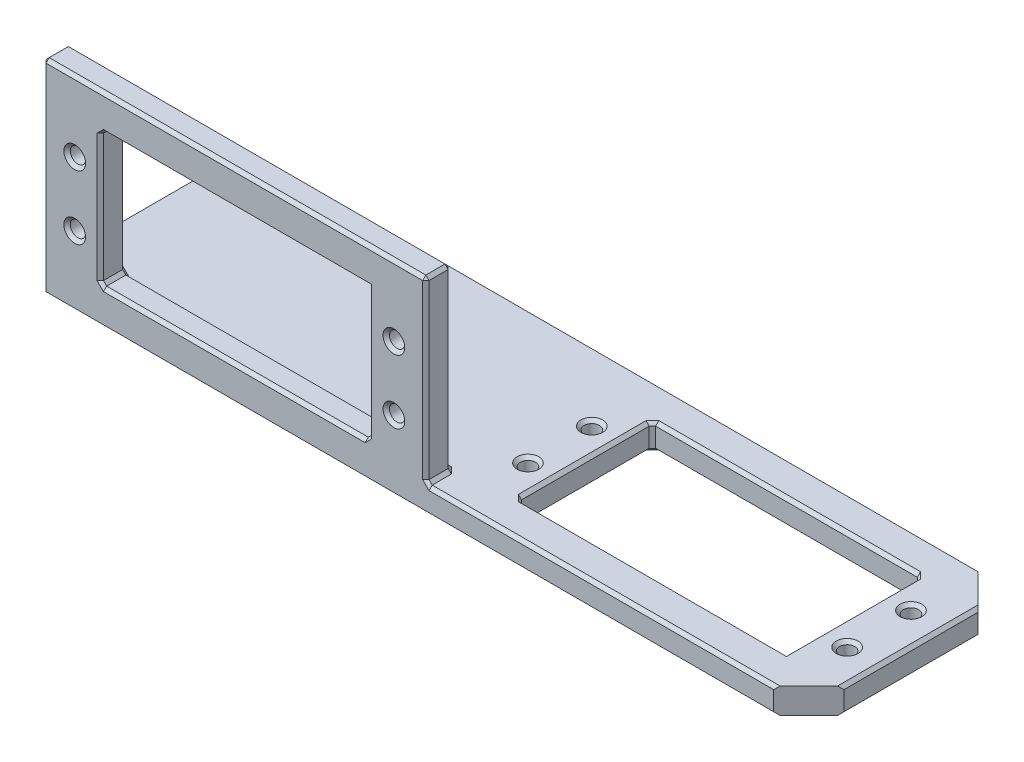
from build123d import *

# Parameters (mm, degrees)
SKETCH2_W           = 120
SKETCH2_H           = 32
BOSS_EXTRUDE1_DEPTH = 4
SKETCH3_R           = 1.2
SKETCH3_W           = 42
SKETCH3_H           = 21
CUT_EXTRUDE1_DEPTH  = 4
SKETCH4_W           = 60
SKETCH4_H           = 32
BOSS_EXTRUDE2_DEPTH = 4
SKETCH5_R           = 1.2
SKETCH5_W           = 42
SKETCH5_H           = 21
CUT_EXTRUDE2_DEPTH  = 76.153176912
CHAMFER1_SIZE       = 0.5
CHAMFER2_SIZE       = 0.5
CUT_EXTRUDE3_DEPTH  = 10


with BuildPart() as part:
    # Sketch2 → Boss-Extrude1 (new body)
    with BuildSketch(Plane(origin=(0, 0, 0), x_dir=(1, 0, 0), z_dir=(0, 1, 0))):
        Rectangle(SKETCH2_W, SKETCH2_H)
    extrude(amount=BOSS_EXTRUDE1_DEPTH)

    # Sketch3 → Cut-Extrude1 (cut)
    with BuildSketch(Plane(origin=(0, 4, 0), x_dir=(1, 0, 0), z_dir=(0, 1, 0))):
        with Locations(Location((55, 5, 0), (0, 0, 270))):
            Circle(SKETCH3_R)
        with Locations(Location((55, -5, 0), (0, 0, 270))):
            Circle(SKETCH3_R)
        with Locations(Location((5, 5, 0), (0, 0, 270))):
            Circle(SKETCH3_R)
        with Locations(Location((5, -5, 0), (0, 0, 270))):
            Circle(SKETCH3_R)
        with Locations((30, 0)):
            Rectangle(SKETCH3_W, SKETCH3_H)
    extrude(amount=-CUT_EXTRUDE1_DEPTH, mode=Mode.SUBTRACT)

    # Sketch4 → Boss-Extrude2 (add)
    with BuildSketch(Plane.XY.offset(16)):
        with Locations((-30, 16)):
            Rectangle(SKETCH4_W, SKETCH4_H)
    extrude(amount=-BOSS_EXTRUDE2_DEPTH)

    # Sketch5 → Cut-Extrude2 (cut, through all)
    with BuildSketch(Plane.XY.offset(16)):
        with Locations((-5, 21)):
            Circle(SKETCH5_R)
        with Locations((-5, 11)):
            Circle(SKETCH5_R)
        with Locations((-55, 21)):
            Circle(SKETCH5_R)
        with Locations((-55, 11)):
            Circle(SKETCH5_R)
        with Locations((-30, 16)):
            Rectangle(SKETCH5_W, SKETCH5_H)
    extrude(amount=-CUT_EXTRUDE2_DEPTH, mode=Mode.SUBTRACT)

    # Chamfer1
    chamfer1_edges = [part.edges().sort_by_distance(p)[0] for p in [
        (-60, 4, -2),
        (5, 0, 3.8),
        (5, 4, 3.8),
        (5, 0, -6.2),
        (5, 4, -6.2),
        (55, 0, 3.8),
        (55, 4, 3.8),
        (55, 0, -6.2),
        (55, 4, -6.2),
        (51, 0, 0),
        (51, 2, -10.5),
        (30, 0, 10.5),
        (9, 0, 0),
        (9, 2, 10.5),
        (30, 0, -10.5),
        (9, 2, -10.5),
        (51, 4, 0),
        (30, 4, -10.5),
        (9, 4, 0),
        (30, 4, 10.5),
        (60, 4, 0),
        (0, 0, 16),
        (30, 4, 16),
        (-60, 18, 12),
        (-30, 32, 12),
        (-60, 32, 14),
        (0, 4, 14),
        (0, 18, 12),
        (0, 32, 14),
        (-30, 4, 12),
        (0, 18, 16),
        (-30, 32, 16),
        (60, 0, 0),
        (-30, 26.5, 12),
        (-51, 16, 12),
        (-30, 5.5, 12),
        (-9, 16, 12),
        (0, 4, -16),
        (60, 2, 16),
        (-56.2, 11, 12),
        (-56.2, 11, 16),
        (-60, 16, 16),
        (60, 2, -16),
        (-56.2, 21, 12),
        (-56.2, 21, 16),
        (-6.2, 11, 12),
        (-6.2, 11, 16),
        (-6.2, 21, 12),
        (-6.2, 21, 16),
        (-9, 5.5, 14),
        (-51, 5.5, 14),
        (-51, 26.5, 14),
        (-9, 16, 16),
        (-30, 26.5, 16),
        (-51, 16, 16),
        (-30, 5.5, 16),
    ]]
    chamfer(chamfer1_edges, length=CHAMFER1_SIZE)

    # Chamfer2
    chamfer2_edges = [part.edges().sort_by_distance(p)[0] for p in [
        (-0.25, 0, -16),
        (51, 2, 10.5),
        (-60, 1.75, -16),
        (-60, 0, -0.25),
    ]]
    chamfer(chamfer2_edges, length=CHAMFER2_SIZE)

    # Sketch7 → Cut-Extrude3 (cut)
    with BuildSketch(Plane(origin=(0, 4, 0), x_dir=(1, 0, 0), z_dir=(0, 1, 0))):
        Polygon((54.5, 16), (60, 10.5), (63.32506638, 18.331753403), align=None)
        Polygon((54.5, -16), (60, -10.5), (62.093529184, -22.512212848), align=None)
    extrude(amount=-CUT_EXTRUDE3_DEPTH, mode=Mode.SUBTRACT)


solid = part.part
